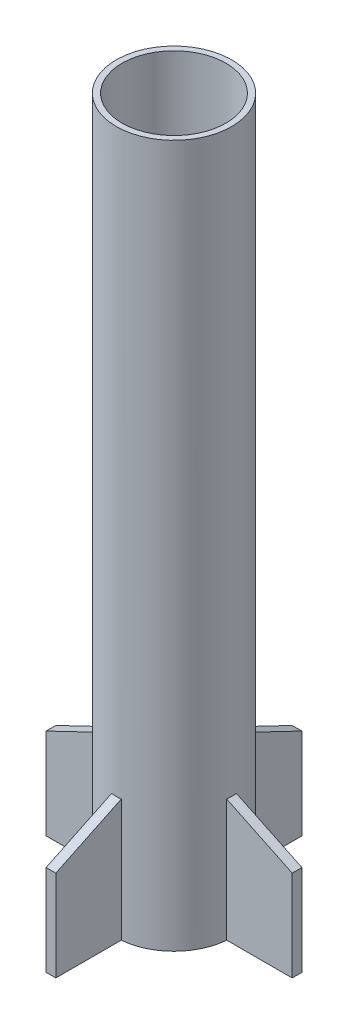
from build123d import *

# Parameters (mm, degrees)
SKETCH1_R                = 11.925
SKETCH1_R_2              = 9.525
BOSS_EXTRUDE1_DEPTH      = 145
BOSS_EXTRUDE2_DEPTH      = 1
CIRPATTERN1_COUNT        = 4
SKETCH3_R                = 7.325
SKETCH3_R_2              = 6.125
BOSS_EXTRUDE3_DEPTH      = 87.75
CUT_EXTRUDE1_START       = -19
SKETCH4_R                = 10.725
SKETCH4_R_2              = 9.525
CUT_EXTRUDE1_DEPTH       = 19
BOSS_EXTRUDE4_START      = -1
SKETCH5_R                = 9.525
SKETCH5_R_2              = 6.125
BOSS_EXTRUDE4_DEPTH      = 1
BOSS_EXTRUDE5_DEPTH      = 0.5
BOSS_EXTRUDE5_DEPTH_BACK = 0.5
SKETCH6_R                = 9.525
SKETCH6_R_2              = 6.125
SKETCH7_R                = 9.525
SKETCH7_R_2              = 6.125
BOSS_EXTRUDE6_DEPTH      = 1


with BuildPart() as part:
    # Sketch1 → Boss-Extrude1 (new body)
    with BuildSketch(Plane(origin=(0, 0, 0), x_dir=(1, 0, 0), z_dir=(0, 1, 0))):
        with Locations(Location((0, 0, 0), (0, 0, 270))):
            Circle(SKETCH1_R)
        with Locations(Location((0, 0, 0), (0, 0, 270))):
            Circle(SKETCH1_R_2, mode=Mode.SUBTRACT)
    extrude(amount=BOSS_EXTRUDE1_DEPTH)

    # Sketch2 → Boss-Extrude2 (add, symmetric)
    with BuildSketch(Plane.XY):
        Polygon((-9.525, 0), (-9.525, 0.375), (-6.397493745, 0.375), (-6.397493745, 25.875), (-9.525, 25.875), (-9.525, 26.25), (-9.780127693, 26.25), (-25.405127693, 18.75), (-25.405127693, 0), align=None)
    boss_extrude2 = extrude(amount=BOSS_EXTRUDE2_DEPTH, both=True)

    # CirPattern1: Boss-Extrude2 ×4 about axis
    cirpattern1_axis = Axis((0, 0, 0), (0, 1, 0))
    for i in range(1, CIRPATTERN1_COUNT):
        add(boss_extrude2.rotate(cirpattern1_axis, i * 360 / CIRPATTERN1_COUNT))

    # Sketch4 → Cut-Extrude1 (cut)
    with BuildSketch(Plane(origin=(0, 145, 0), x_dir=(1, 0, 0), z_dir=(0, 1, 0)).offset(CUT_EXTRUDE1_START)):
        with Locations(Location((0, 0, 0), (0, 0, 270))):
            Circle(SKETCH4_R)
        with Locations(Location((0, 0, 0), (0, 0, 270))):
            Circle(SKETCH4_R_2, mode=Mode.SUBTRACT)
    extrude(amount=CUT_EXTRUDE1_DEPTH, mode=Mode.SUBTRACT)



with BuildPart() as body_2:
    # Sketch3 → Boss-Extrude3 (new body)
    with BuildSketch(Plane.XZ):
        with Locations(Location((0, 0, 0), (0, 0, 270))):
            Circle(SKETCH3_R)
        with Locations(Location((0, 0, 0), (0, 0, 270))):
            Circle(SKETCH3_R_2, mode=Mode.SUBTRACT)
    extrude(amount=-BOSS_EXTRUDE3_DEPTH)


with BuildPart() as part_1:
    add(part.part)

    add(body_2.part)  # Boss-Extrude4 merges body 2
    # Sketch5 → Boss-Extrude4 (add)
    with BuildSketch(Plane(origin=(0, 87.75, 0), x_dir=(1, 0, 0), z_dir=(0, 1, 0)).offset(BOSS_EXTRUDE4_START)):
        with Locations(Location((0, 0, 0), (0, 0, 90))):
            Circle(SKETCH5_R)
        with Locations(Location((0, 0, 0), (0, 0, 90))):
            Circle(SKETCH5_R_2, mode=Mode.SUBTRACT)
    extrude(amount=BOSS_EXTRUDE4_DEPTH)

    # Sketch6 → Boss-Extrude5 (add, two sides: drawn at the far end of the back side and taken through both)
    with BuildSketch(Plane(origin=(0, 43.875, 0), x_dir=(1, 0, 0), z_dir=(0, 1, 0)).offset(-BOSS_EXTRUDE5_DEPTH_BACK)):
        with Locations(Location((0, 0, 0), (0, 0, 270))):
            Circle(SKETCH6_R)
        with Locations(Location((0, 0, 0), (0, 0, 90))):
            Circle(SKETCH6_R_2, mode=Mode.SUBTRACT)
    extrude(amount=BOSS_EXTRUDE5_DEPTH + BOSS_EXTRUDE5_DEPTH_BACK)

    # Sketch7 → Boss-Extrude6 (add)
    with BuildSketch(Plane.XZ):
        with Locations(Location((0, 0, 0), (0, 0, 270))):
            Circle(SKETCH7_R)
        with Locations(Location((0, 0, 0), (0, 0, 270))):
            Circle(SKETCH7_R_2, mode=Mode.SUBTRACT)
    extrude(amount=-BOSS_EXTRUDE6_DEPTH)


solid = part_1.part
